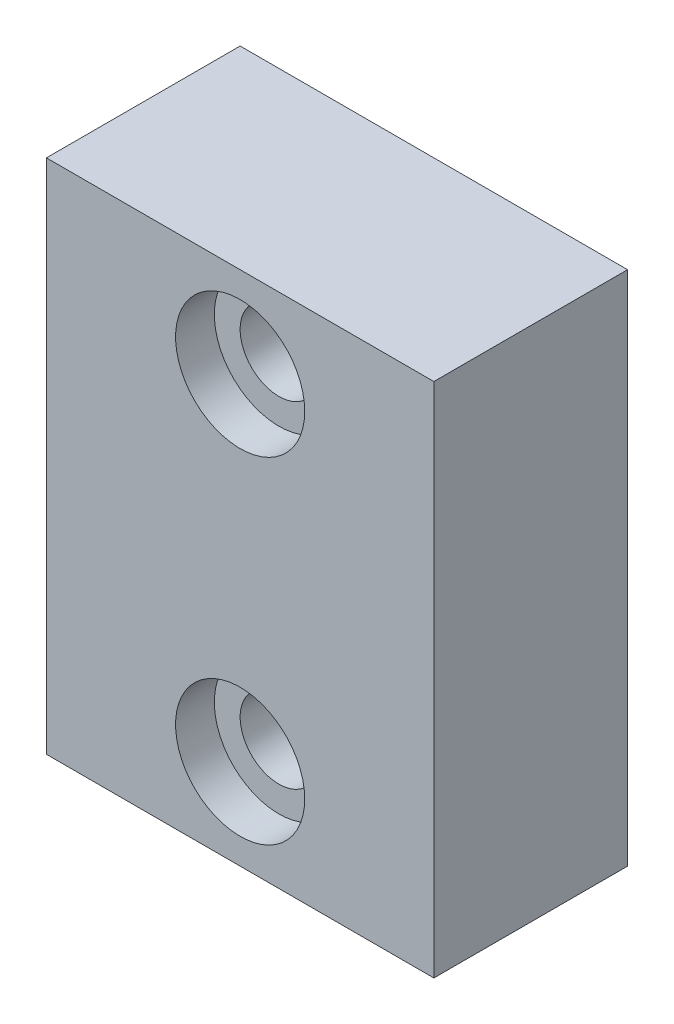
from build123d import *

# Parameters (mm, degrees)
IZIM1_W                     = 15
IZIM1_H                     = 20
Y_KSEKLIK_EKSTR_ZYON1_DEPTH = 7.5
IZIM2_R                     = 1.5
KES_EKSTR_ZYON1_DEPTH       = 7.5
IZIM3_R                     = 2.5
KES_EKSTR_ZYON2_DEPTH       = 1.5


with BuildPart() as part:
    # Çizim1 → Yükseklik-Ekstrüzyon1 (new body)
    with BuildSketch(Plane.XY):
        with Locations((0.901187863, -6.71875)):
            Rectangle(IZIM1_W, IZIM1_H)
    extrude(amount=Y_KSEKLIK_EKSTR_ZYON1_DEPTH)

    # Çizim2 → Kes-Ekstrüzyon1 (cut)
    with BuildSketch(Plane.XY.offset(7.5)):
        with Locations((0.901187863, -0.21875)):
            Circle(IZIM2_R)
        with Locations((0.901187863, -13.21875)):
            Circle(IZIM2_R)
    extrude(amount=-KES_EKSTR_ZYON1_DEPTH, mode=Mode.SUBTRACT)

    # Çizim3 → Kes-Ekstrüzyon2 (cut)
    with BuildSketch(Plane.XY.offset(7.5)):
        with Locations((0.901187863, -0.21875)):
            Circle(IZIM3_R)
        with Locations((0.901187863, -13.21875)):
            Circle(IZIM3_R)
    extrude(amount=-KES_EKSTR_ZYON2_DEPTH, mode=Mode.SUBTRACT)


solid = part.part
